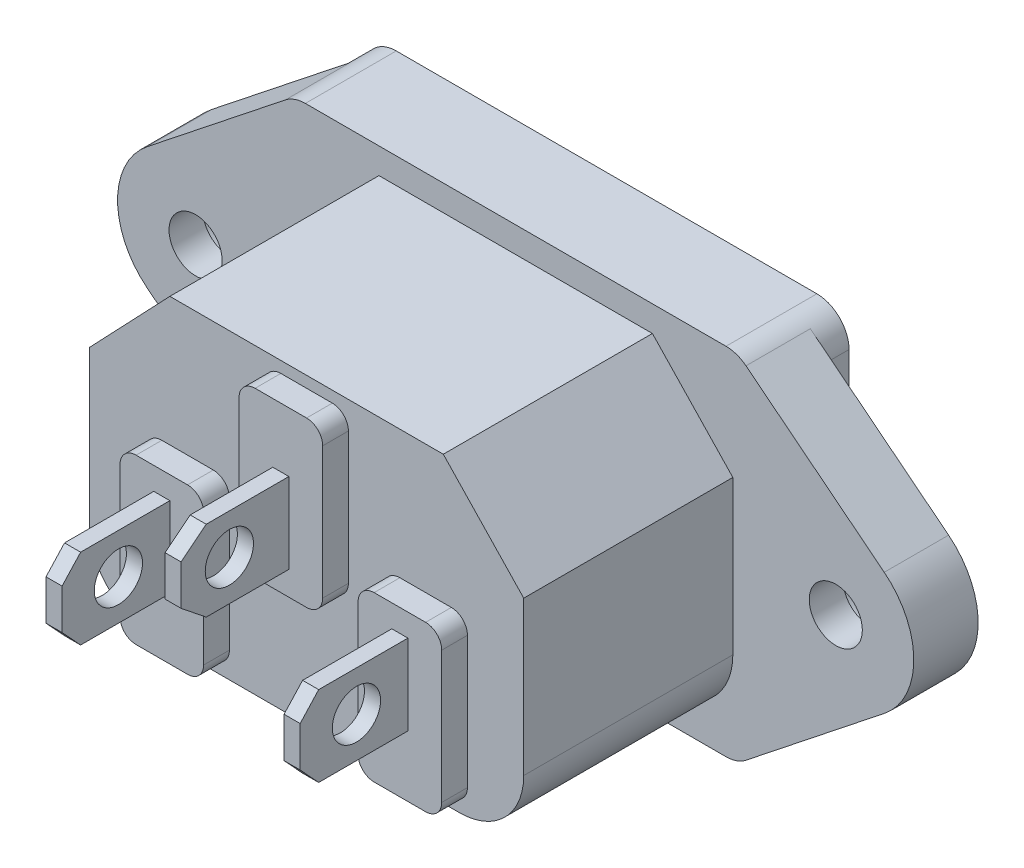
from build123d import *

# Parameters (mm, degrees)
BOSS_EXTRUDE1_DEPTH = 1.65
SKETCH2_R           = 1.650000009
BOSS_EXTRUDE2_DEPTH = 4
BOSS_EXTRUDE3_DEPTH = 13
CUT_EXTRUDE1_DEPTH  = 16.5
FILLET1_R           = 4
FILLET2_R           = 3
SKETCH5_R           = 2.5
CUT_EXTRUDE2_DEPTH  = 1.9
SKETCH6_W           = 5.2
SKETCH6_H           = 10.2
BOSS_EXTRUDE4_DEPTH = 1.6
FILLET3_R           = 1
SKETCH7_W           = 2.1
SKETCH7_H           = 4
BOSS_EXTRUDE5_DEPTH = 15.2
FILLET4_R           = 1
SKETCH8_W           = 1
SKETCH8_H           = 5
BOSS_EXTRUDE6_DEPTH = 6.7
SKETCH9_R           = 1.5
CUT_EXTRUDE3_DEPTH  = 44.75417123
CUT_EXTRUDE4_REACH  = 40.548
SKETCH10_R          = 1.5


with BuildPart() as part:
    # Sketch1 → Boss-Extrude1 (new body)
    with BuildSketch(Plane.XY):
        with BuildLine():
            Line((-13.075, -11.05), (13.075, -11.05))
            ThreePointArc((13.075, -11.05), (14.489213562, -10.464213562), (15.075, -9.05))
            Line((15.075, -9.05), (15.075, 9.05))
            ThreePointArc((15.075, 9.05), (14.489213562, 10.464213562), (13.075, 11.05))
            Line((13.075, 11.05), (-13.075, 11.05))
            ThreePointArc((-13.075, 11.05), (-14.489213562, 10.464213562), (-15.075, 9.05))
            Line((-15.075, 9.05), (-15.075, -9.05))
            ThreePointArc((-15.075, -9.05), (-14.489213562, -10.464213562), (-13.075, -11.05))
        make_face()
    extrude(amount=BOSS_EXTRUDE1_DEPTH)

    # Sketch2 → Boss-Extrude2 (add)
    with BuildSketch(Plane.XY.offset(1.65)):
        with BuildLine():
            Line((14.317737301, 10.617036694), (22.913637955, 3.800063983))
            ThreePointArc((22.913637955, 3.800063983), (24.75, 0), (22.913637955, -3.800063983))
            Line((22.913637955, -3.800063983), (14.317737301, -10.617036694))
            ThreePointArc((14.317737301, -10.617036694), (13.732999473, -10.938660026), (13.075, -11.05))
            Line((13.075, -11.05), (-13.075, -11.05))
            ThreePointArc((-13.075, -11.05), (-13.732999473, -10.938660026), (-14.317737301, -10.617036694))
            Line((-14.317737301, -10.617036694), (-22.913637955, -3.800063983))
            ThreePointArc((-22.913637955, -3.800063983), (-24.75, 0), (-22.913637955, 3.800063983))
            Line((-22.913637955, 3.800063983), (-14.317737301, 10.617036694))
            ThreePointArc((-14.317737301, 10.617036694), (-13.732999473, 10.938660026), (-13.075, 11.05))
            Line((-13.075, 11.05), (13.075, 11.05))
            ThreePointArc((13.075, 11.05), (13.732999473, 10.938660026), (14.317737301, 10.617036694))
        make_face()
        with Locations((19.9, 0)):
            Circle(SKETCH2_R, mode=Mode.SUBTRACT)
        with Locations((-19.9, 0)):
            Circle(SKETCH2_R, mode=Mode.SUBTRACT)
    extrude(amount=BOSS_EXTRUDE2_DEPTH)

    # Sketch3 → Boss-Extrude3 (add)
    with BuildSketch(Plane.XY.offset(5.65)):
        Polygon((-8.5, 9.45), (8.5, 9.45), (13.5, 4.2), (13.5, -9.35), (-13.5, -9.35), (-13.5, 4.2), align=None)
    extrude(amount=BOSS_EXTRUDE3_DEPTH)

    # Sketch4 → Cut-Extrude1 (cut)
    with BuildSketch(Plane(origin=(0, 0, 0), x_dir=(-1, 0, 0), z_dir=(0, 0, -1))):
        Polygon((-8.35, 7.95), (8.35, 7.95), (12, 4.55), (12, -7.65), (-12, -7.65), (-12, 4.55), align=None)
    extrude(amount=-CUT_EXTRUDE1_DEPTH, mode=Mode.SUBTRACT)

    # Fillet1
    fillet1_edges = [part.edges().sort_by_distance(p)[0] for p in [
        (-13.5, -9.35, 12.15),
        (13.5, -9.35, 12.15),
    ]]
    fillet(fillet1_edges, radius=FILLET1_R)

    # Fillet2
    fillet2_edges = [part.edges().sort_by_distance(p)[0] for p in [
        (-12, -7.65, 8.25),
        (12, -7.65, 8.25),
    ]]
    fillet(fillet2_edges, radius=FILLET2_R)

    # Sketch5 → Cut-Extrude2 (cut)
    with BuildSketch(Plane(origin=(0, 0, 1.65), x_dir=(-1, 0, 0), z_dir=(0, 0, -1))):
        with Locations((-19.9, 0)):
            Circle(SKETCH5_R)
        with Locations((19.9, 0)):
            Circle(SKETCH5_R)
    extrude(amount=-CUT_EXTRUDE2_DEPTH, mode=Mode.SUBTRACT)

    # Sketch6 → Boss-Extrude4 (add)
    with BuildSketch(Plane.XY.offset(18.65)):
        with Locations((0, 3.65)):
            Rectangle(SKETCH6_W, SKETCH6_H)
        with Locations((7.4, -3.65)):
            Rectangle(SKETCH6_W, SKETCH6_H)
        with Locations((-7.4, -3.65)):
            Rectangle(SKETCH6_W, SKETCH6_H)
    extrude(amount=BOSS_EXTRUDE4_DEPTH)

    # Fillet3
    fillet3_edges = [part.edges().sort_by_distance(p)[0] for p in [
        (-2.6, 8.75, 19.45),
        (-2.6, -1.45, 19.45),
        (2.6, -1.45, 19.45),
        (2.6, 8.75, 19.45),
        (4.8, 1.45, 19.45),
        (4.8, -8.75, 19.45),
        (10, -8.75, 19.45),
        (10, 1.45, 19.45),
        (-10, 1.45, 19.45),
        (-10, -8.75, 19.45),
        (-4.8, -8.75, 19.45),
        (-4.8, 1.45, 19.45),
    ]]
    fillet(fillet3_edges, radius=FILLET3_R)

    # Sketch7 → Boss-Extrude5 (add)
    with BuildSketch(Plane(origin=(0, 0, 16.5), x_dir=(-1, 0, 0), z_dir=(0, 0, -1))):
        with Locations((0, 2.05)):
            Rectangle(SKETCH7_W, SKETCH7_H)
        with Locations((-7.4, -2.05)):
            Rectangle(SKETCH7_W, SKETCH7_H)
        with Locations((7.4, -2.05)):
            Rectangle(SKETCH7_W, SKETCH7_H)
    extrude(amount=BOSS_EXTRUDE5_DEPTH)

    # Fillet4
    fillet4_edges = [part.edges().sort_by_distance(p)[0] for p in [
        (1.05, 2.05, 1.3),
        (-1.05, 2.05, 1.3),
        (8.45, -2.05, 1.3),
        (6.35, -2.05, 1.3),
        (-6.35, -2.05, 1.3),
        (-8.45, -2.05, 1.3),
    ]]
    fillet(fillet4_edges, radius=FILLET4_R)

    # Sketch8 → Boss-Extrude6 (add)
    with BuildSketch(Plane.XY.offset(20.25)):
        with Locations((-7.4, -2.45)):
            Rectangle(SKETCH8_W, SKETCH8_H)
        with Locations((0, 2.55)):
            Rectangle(SKETCH8_W, SKETCH8_H)
        with Locations((7.4, -2.45)):
            Rectangle(SKETCH8_W, SKETCH8_H)
    extrude(amount=BOSS_EXTRUDE6_DEPTH)

    # Sketch9 → Cut-Extrude3 (cut, through all)
    with BuildSketch(Plane.ZY.offset(7.9)):
        with Locations((23.45, -2.45)):
            Circle(SKETCH9_R)
        Polygon((25.797828138, 0.05), (26.95, -1.2), (26.95, 0.05), align=None)
        Polygon((26.95, -3.7), (25.797828138, -4.95), (26.95, -4.95), align=None)
    extrude(amount=-CUT_EXTRUDE3_DEPTH, mode=Mode.SUBTRACT)

    # Sketch10 → Cut-Extrude4 (cut, up to next)
    with BuildSketch(Plane.ZY.offset(0.5), mode=Mode.PRIVATE) as cut_extrude4_sk1:
        with Locations((23.95, 2.55)):
            Circle(SKETCH10_R)
    cut_extrude4_tool1 = extrude(cut_extrude4_sk1.sketch, amount=-CUT_EXTRUDE4_REACH, mode=Mode.PRIVATE) & part.part
    # Sketch10 → Cut-Extrude4 (cut, up to next)
    with BuildSketch(Plane.ZY.offset(0.5), mode=Mode.PRIVATE) as cut_extrude4_sk2:
        Polygon((25.3887505, 5.05), (26.95, 3.8), (26.95, 5.05), align=None)
    cut_extrude4_tool2 = extrude(cut_extrude4_sk2.sketch, amount=-CUT_EXTRUDE4_REACH, mode=Mode.PRIVATE) & part.part
    # Sketch10 → Cut-Extrude4 (cut, up to next)
    with BuildSketch(Plane.ZY.offset(0.5), mode=Mode.PRIVATE) as cut_extrude4_sk3:
        Polygon((26.95, 1.3), (25.3887505, 0.05), (26.95, 0.05), align=None)
    cut_extrude4_tool3 = extrude(cut_extrude4_sk3.sketch, amount=-CUT_EXTRUDE4_REACH, mode=Mode.PRIVATE) & part.part
    add(cut_extrude4_tool1.solids().sort_by_distance((-0.5, 2.55, 23.95))[0], mode=Mode.SUBTRACT)
    add(cut_extrude4_tool2.solids().sort_by_distance((-0.5, 4.633333, 26.429584))[0], mode=Mode.SUBTRACT)
    add(cut_extrude4_tool3.solids().sort_by_distance((-0.5, 0.466667, 26.429584))[0], mode=Mode.SUBTRACT)


solid = part.part
